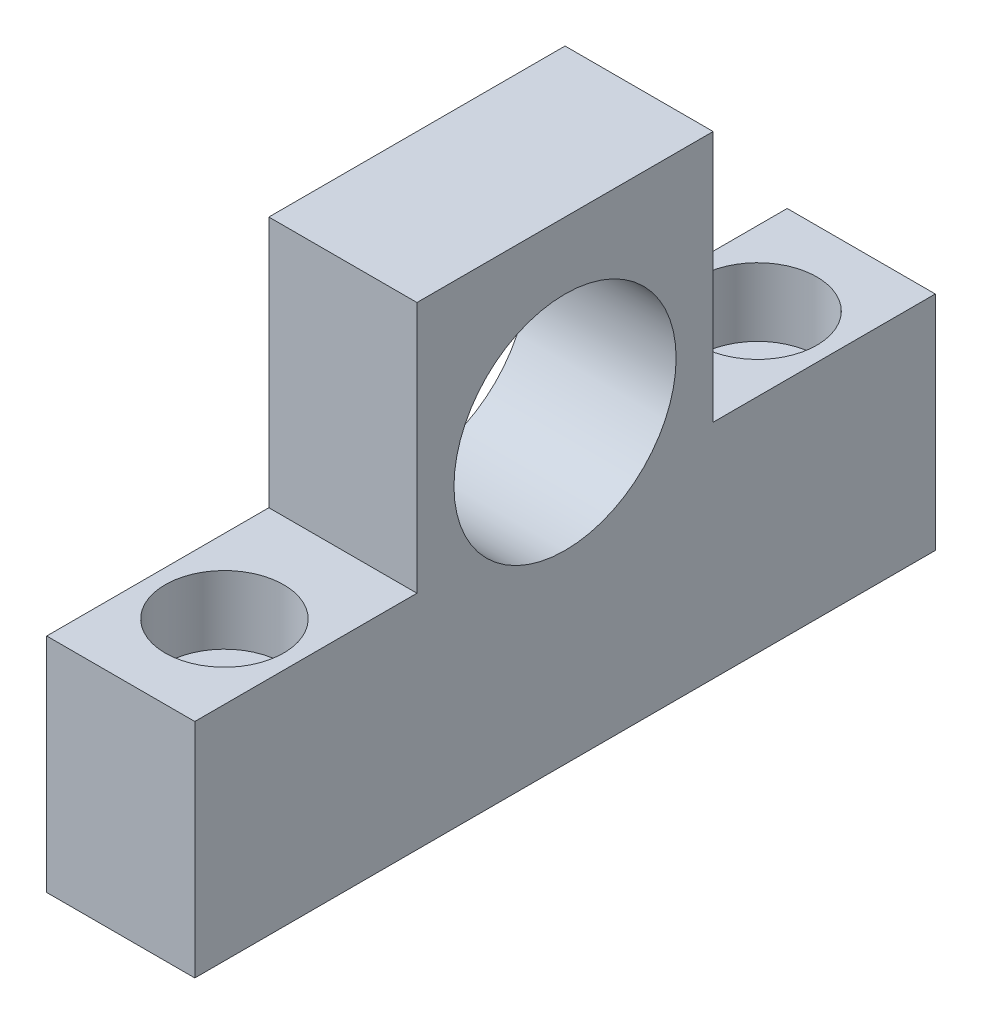
from build123d import *

# Parameters (mm, degrees)
SKETCH_1_R                   = 7.5
EXTRUDE_1_DEPTH              = 10
HOLE_WIZARD_M4_1_D           = 4.5
HOLE_WIZARD_M4_1_CBORE_D     = 8
HOLE_WIZARD_M4_1_CBORE_DEPTH = 4.6


with BuildPart() as part:
    # 草图1 → 凸台-拉伸1 (new body)
    with BuildSketch(Plane(origin=(0, 0, 0), x_dir=(0, 0, -1), z_dir=(1, 0, 0))):
        Polygon((0, 0), (50, 0), (50, 15), (35, 15), (35, 32), (15, 32), (15, 15), (0, 15), align=None)
        with Locations((25, 20)):
            Circle(SKETCH_1_R, mode=Mode.SUBTRACT)
    extrude(amount=EXTRUDE_1_DEPTH)

    # M4 六角圆柱头螺钉的柱形沉头孔1 (through all)
    with Locations(Plane(origin=(5, 15, -43), x_dir=(0, 0, 1), z_dir=(0, 1, 0))):
        with Locations((0, 0), (36, 0)):
            CounterBoreHole(HOLE_WIZARD_M4_1_D / 2, HOLE_WIZARD_M4_1_CBORE_D / 2, HOLE_WIZARD_M4_1_CBORE_DEPTH)


solid = part.part
